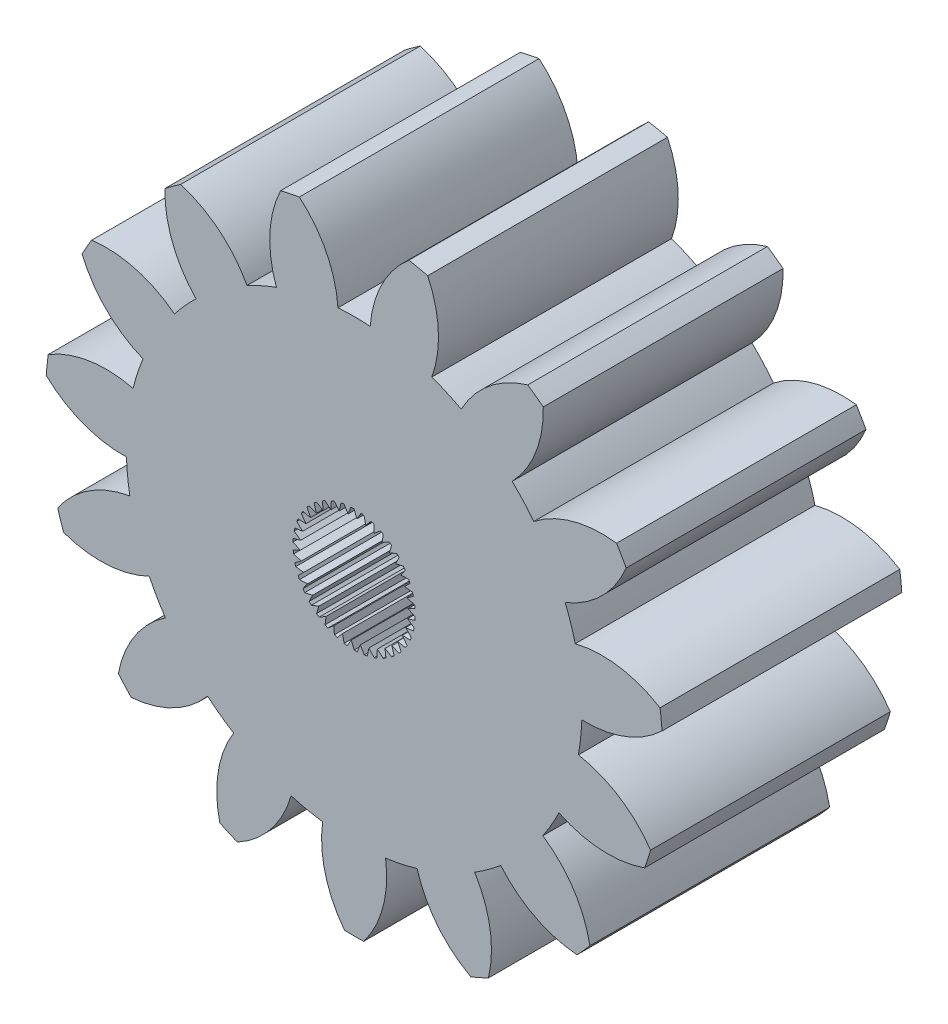
from build123d import *

# Parameters (mm, degrees)
SKETCH1_R           = 70.548036847
BOSS_EXTRUDE1_DEPTH = 10
SKETCH3_R           = 367.512428381
SKETCH3_R_2         = 2.25
CUT_EXTRUDE2_DEPTH  = 269.283414963
CUT_EXTRUDE4_DEPTH  = 10


with BuildPart() as part:
    # Sketch1 → Boss-Extrude1 (new body)
    with BuildSketch(Plane.XY):
        Circle(SKETCH1_R)
    extrude(amount=BOSS_EXTRUDE1_DEPTH)

    # Sketch3 → Cut-Extrude2 (cut, through all)
    # profile 1 of 2: a face of its own
    with BuildSketch(Plane(origin=(55.025604462, -141.718387499, 105.594585314), x_dir=(1, 0, 0), z_dir=(0, 0, 1))):
        with Locations((-43.46157653, 148.105383059)):
            Circle(SKETCH3_R)
        with BuildLine():
            ThreePointArc((-36.221197708, 158.75404699), (-37.83485513, 157.900828095), (-38.992966759, 156.489924055))
            ThreePointArc((-38.992966759, 156.489924055), (-39.597171684, 156.784978452), (-40.22073184, 157.036560288))
            ThreePointArc((-40.22073184, 157.036560288), (-39.94715374, 158.841284028), (-40.392836102, 160.611380068))
            ThreePointArc((-40.392836102, 160.611380068), (-40.784297687, 160.700989713), (-41.178363167, 160.778349))
            ThreePointArc((-41.178363167, 160.778349), (-42.305477185, 159.342561151), (-42.78959843, 157.582589738))
            ThreePointArc((-42.78959843, 157.582589738), (-43.46157653, 157.606383059), (-44.133554629, 157.582589738))
            ThreePointArc((-44.133554629, 157.582589738), (-44.617675875, 159.342561151), (-45.744789893, 160.778349))
            ThreePointArc((-45.744789893, 160.778349), (-46.138855372, 160.700989713), (-46.530316958, 160.611380068))
            ThreePointArc((-46.530316958, 160.611380068), (-46.97599932, 158.841284028), (-46.702421219, 157.036560288))
            ThreePointArc((-46.702421219, 157.036560288), (-47.325981376, 156.784978452), (-47.930186301, 156.489924055))
            ThreePointArc((-47.930186301, 156.489924055), (-49.08829793, 157.900828095), (-50.701955351, 158.75404699))
            ThreePointArc((-50.701955351, 158.75404699), (-51.030487224, 158.523094895), (-51.35165765, 158.282010639))
            ThreePointArc((-51.35165765, 158.282010639), (-51.038845826, 156.483672095), (-50.05487252, 154.946249158))
            ThreePointArc((-50.05487252, 154.946249158), (-50.522195517, 154.46279295), (-50.954154746, 153.947495063))
            ThreePointArc((-50.954154746, 153.947495063), (-52.586008738, 154.765373604), (-54.407193534, 154.888494247))
            ThreePointArc((-54.407193534, 154.888494247), (-54.613385654, 154.543883059), (-54.808731638, 154.193009851))
            ThreePointArc((-54.808731638, 154.193009851), (-53.791513634, 152.677377874), (-52.267283045, 151.673090132))
            ThreePointArc((-52.267283045, 151.673090132), (-52.497564491, 151.041353522), (-52.682588351, 150.394911831))
            ThreePointArc((-52.682588351, 150.394911831), (-54.506022324, 150.478346243), (-56.2198351, 149.850079957))
            ThreePointArc((-56.2198351, 149.850079957), (-56.268034976, 149.45139608), (-56.303779421, 149.051403085))
            ThreePointArc((-56.303779421, 149.051403085), (-54.758041473, 148.080544213), (-52.957106917, 147.783042142))
            ThreePointArc((-52.957106917, 147.783042142), (-52.910529058, 147.112258129), (-52.816625241, 146.446448275))
            ThreePointArc((-52.816625241, 146.446448275), (-54.516350897, 145.78101199), (-55.826457853, 144.509991723))
            ThreePointArc((-55.826457853, 144.509991723), (-55.70833129, 144.126171222), (-55.578293657, 143.746220863))
            ThreePointArc((-55.578293657, 143.746220863), (-53.771307897, 143.488005415), (-52.00506732, 143.948729824))
            ThreePointArc((-52.00506732, 143.948729824), (-51.689683891, 143.354883059), (-51.333089221, 142.784829614))
            ThreePointArc((-51.333089221, 142.784829614), (-52.615208552, 141.485582611), (-53.295080294, 139.791579314))
            ThreePointArc((-53.295080294, 139.791579314), (-53.031052447, 139.488988241), (-52.757717425, 139.194777386))
            ThreePointArc((-52.757717425, 139.194777386), (-51.001928107, 139.693853159), (-49.575780551, 140.833140613))
            ThreePointArc((-49.575780551, 140.833140613), (-49.046124212, 140.418912595), (-48.488497146, 140.04318298))
            ThreePointArc((-48.488497146, 140.04318298), (-49.131320073, 138.334776868), (-49.0634006, 136.510699101))
            ThreePointArc((-49.0634006, 136.510699101), (-48.699124283, 136.341658201), (-48.329753979, 136.18405858))
            ThreePointArc((-48.329753979, 136.18405858), (-46.928753027, 137.354130838), (-46.08929236, 138.974988187))
            ThreePointArc((-46.08929236, 138.974988187), (-45.436945504, 138.812002704), (-44.774704829, 138.695563981))
            ThreePointArc((-44.774704829, 138.695563981), (-44.667081426, 136.873397699), (-43.863114633, 135.234645079))
            ThreePointArc((-43.863114633, 135.234645079), (-43.46157653, 135.228383059), (-43.060038426, 135.234645079))
            ThreePointArc((-43.060038426, 135.234645079), (-42.256071633, 136.873397699), (-42.148448231, 138.695563981))
            ThreePointArc((-42.148448231, 138.695563981), (-41.486207555, 138.812002704), (-40.833860699, 138.974988187))
            ThreePointArc((-40.833860699, 138.974988187), (-39.994400032, 137.354130838), (-38.59339908, 136.18405858))
            ThreePointArc((-38.59339908, 136.18405858), (-38.224028777, 136.341658201), (-37.859752459, 136.510699101))
            ThreePointArc((-37.859752459, 136.510699101), (-37.791832987, 138.334776868), (-38.434655913, 140.04318298))
            ThreePointArc((-38.434655913, 140.04318298), (-37.877028848, 140.418912595), (-37.347372509, 140.833140613))
            ThreePointArc((-37.347372509, 140.833140613), (-35.921224952, 139.693853159), (-34.165435634, 139.194777386))
            ThreePointArc((-34.165435634, 139.194777386), (-33.892100612, 139.488988241), (-33.628072765, 139.791579314))
            ThreePointArc((-33.628072765, 139.791579314), (-34.307944507, 141.485582611), (-35.590063839, 142.784829614))
            ThreePointArc((-35.590063839, 142.784829614), (-35.233469168, 143.354883059), (-34.918085739, 143.948729824))
            ThreePointArc((-34.918085739, 143.948729824), (-33.151845163, 143.488005415), (-31.344859402, 143.746220863))
            ThreePointArc((-31.344859402, 143.746220863), (-31.214821769, 144.126171222), (-31.096695206, 144.509991723))
            ThreePointArc((-31.096695206, 144.509991723), (-32.406802163, 145.78101199), (-34.106527819, 146.446448275))
            ThreePointArc((-34.106527819, 146.446448275), (-34.012624002, 147.112258129), (-33.966046143, 147.783042142))
            ThreePointArc((-33.966046143, 147.783042142), (-32.165111587, 148.080544213), (-30.619373638, 149.051403085))
            ThreePointArc((-30.619373638, 149.051403085), (-30.655118083, 149.45139608), (-30.70331796, 149.850079957))
            ThreePointArc((-30.70331796, 149.850079957), (-32.417130736, 150.478346243), (-34.240564709, 150.394911831))
            ThreePointArc((-34.240564709, 150.394911831), (-34.425588568, 151.041353522), (-34.655870014, 151.673090132))
            ThreePointArc((-34.655870014, 151.673090132), (-33.131639425, 152.677377874), (-32.114421422, 154.193009851))
            ThreePointArc((-32.114421422, 154.193009851), (-32.309767405, 154.543883059), (-32.515959525, 154.888494247))
            ThreePointArc((-32.515959525, 154.888494247), (-34.337144322, 154.765373604), (-35.968998313, 153.947495063))
            ThreePointArc((-35.968998313, 153.947495063), (-36.400957543, 154.46279295), (-36.86828054, 154.946249158))
            ThreePointArc((-36.86828054, 154.946249158), (-35.884307233, 156.483672095), (-35.571495409, 158.282010639))
            ThreePointArc((-35.571495409, 158.282010639), (-35.892665836, 158.523094895), (-36.221197708, 158.75404699))
        make_face(mode=Mode.SUBTRACT)
    # profile 2 of 2: a face of its own
    with BuildSketch(Plane(origin=(55.025604462, -141.718387499, 105.594585314), x_dir=(1, 0, 0), z_dir=(0, 0, 1))):
        with Locations((-43.46157653, 148.105383059)):
            Circle(SKETCH3_R_2)
    extrude(amount=-CUT_EXTRUDE2_DEPTH, mode=Mode.SUBTRACT)

    # Sketch4 → Cut-Extrude4 (cut)
    with BuildSketch(Plane.XY.offset(10)):
        with BuildLine():
            ThreePointArc((9.619262983, 5.255452678), (9.532463271, 5.419914887), (9.459541205, 5.590983238))
            Line((9.459541205, 5.590983238), (9.229545604, 5.360987636))
            ThreePointArc((9.229545604, 5.360987636), (9.25663155, 5.301444117), (9.285235917, 5.242614963))
            Line((9.285235917, 5.242614963), (9.619262984, 5.255452678))
        make_face()
        with BuildLine():
            Line((9.127956814, 5.633299661), (9.459541205, 5.590983238))
            ThreePointArc((9.459541205, 5.590983238), (9.400994918, 5.76748916), (9.357224339, 5.948226939))
            Line((9.357224339, 5.948226939), (9.092509546, 5.759224209))
            ThreePointArc((9.092509546, 5.759224209), (9.109425534, 5.696034586), (9.127956814, 5.633299661))
        make_face()
        with BuildLine():
            Line((9.037127381, 6.044543218), (9.357224339, 5.948226939))
            ThreePointArc((9.357224339, 5.948226939), (9.328528467, 6.131961952), (9.315103323, 6.317439104))
            Line((9.315103322, 6.317439104), (9.022890067, 6.174584748))
            ThreePointArc((9.022890067, 6.174584748), (9.029174673, 6.109472669), (9.037127381, 6.044543218))
        make_face()
        with BuildLine():
            ThreePointArc((9.832032879, 4.950787658), (9.719347412, 5.098720054), (9.619262983, 5.255452678))
            Line((9.619262984, 5.255452678), (9.430260254, 4.990737885))
            ThreePointArc((9.430260254, 4.990737885), (9.466777324, 4.936464662), (9.504674525, 4.883145984))
            Line((9.504674526, 4.883145985), (9.83203288, 4.950787658))
        make_face()
        with BuildLine():
            Line((9.015225208, 6.465127982), (9.315103322, 6.317439104))
            ThreePointArc((9.315103323, 6.317439104), (9.317040614, 6.503391397), (9.334327107, 6.688548588))
            Line((9.334327106, 6.688548588), (9.022586204, 6.595739301))
            ThreePointArc((9.022586205, 6.595739301), (9.018068001, 6.530480853), (9.015225208, 6.465127982))
        make_face()
        with BuildLine():
            ThreePointArc((10.092047086, 4.685298646), (9.956549629, 4.812666018), (9.832032879, 4.950787658))
            Line((9.83203288, 4.950787658), (9.689178524, 4.658574403))
            ThreePointArc((9.689178524, 4.658574403), (9.734130628, 4.611051908), (9.780286926, 4.564698102))
            Line((9.780286927, 4.564698103), (10.092047086, 4.685298646))
        make_face()
        with BuildLine():
            Line((9.062847729, 6.883581498), (9.334327106, 6.688548588))
            ThreePointArc((9.334327107, 6.688548588), (9.366844717, 6.871645866), (9.414371317, 7.051432491))
            Line((9.414371316, 7.051432492), (9.091606247, 7.011199868))
            ThreePointArc((9.091606249, 7.011199868), (9.076408479, 6.947575132), (9.06284773, 6.883581498))
        make_face()
        with BuildLine():
            ThreePointArc((10.392213092, 4.466227489), (10.237599664, 4.569555588), (10.092047086, 4.685298646))
            Line((10.092047086, 4.685298646), (9.999237799, 4.373557745))
            ThreePointArc((9.999237798, 4.373557744), (10.05139876, 4.334082267), (10.104555132, 4.295957744))
            Line((10.104555133, 4.295957745), (10.392213093, 4.46622749))
        make_face()
        with BuildLine():
            Line((9.178695925, 7.288489444), (9.414371316, 7.051432492))
            ThreePointArc((9.414371317, 7.051432491), (9.476582251, 7.226680338), (9.553052556, 7.396192287))
            Line((9.553052554, 7.396192288), (9.228067509, 7.409633769))
            ThreePointArc((9.22806751, 7.409633768), (9.202604731, 7.349378262), (9.178695926, 7.288489443))
        make_face()
        with BuildLine():
            ThreePointArc((10.724343153, 4.299549879), (10.554831204, 4.376020183), (10.392213092, 4.466227489))
            Line((10.392213093, 4.46622749), (10.351980469, 4.143462422))
            ThreePointArc((10.351980469, 4.143462421), (10.409927472, 4.11311075), (10.468633951, 4.084255447))
            Line((10.468633952, 4.084255448), (10.724343154, 4.29954988))
        make_face()
        with BuildLine():
            Line((9.359609761, 7.668806986), (9.553052554, 7.396192288))
            ThreePointArc((9.553052556, 7.396192287), (9.643259861, 7.558810399), (9.74658796, 7.713423827))
            Line((9.746587959, 7.713423828), (9.428247681, 7.780172765))
            ThreePointArc((9.428247682, 7.780172764), (9.393214452, 7.7249301), (9.359609762, 7.668806986))
        make_face()
        with BuildLine():
            ThreePointArc((11.079377626, 4.189812345), (10.899591001, 4.237338944), (10.724343153, 4.299549879))
            Line((10.724343154, 4.29954988), (10.737784635, 3.974564834))
            ThreePointArc((10.737784634, 3.974564833), (10.799937037, 3.954164882), (10.862592263, 3.935365897))
            Line((10.862592264, 3.935365899), (11.079377626, 4.189812346))
        make_face()
        with BuildLine():
            Line((9.600654378, 8.014160055), (9.746587959, 7.713423828))
            ThreePointArc((9.74658796, 7.713423827), (9.862331017, 7.858976405), (9.98969839, 7.994473862))
            Line((9.989698389, 7.994473863), (9.686686371, 8.112709519))
            ThreePointArc((9.686686372, 8.112709518), (9.643038306, 8.063986572), (9.600654379, 8.014160054))
        make_face()
        with BuildLine():
            ThreePointArc((11.447632096, 4.140008241), (11.262474904, 4.157294734), (11.079377626, 4.189812345))
            Line((11.079377626, 4.189812346), (11.146126563, 3.871472068))
            ThreePointArc((11.146126563, 3.871472066), (11.21078901, 3.861580294), (11.275683911, 3.853350414))
            Line((11.275683912, 3.853350416), (11.447632096, 4.140008243))
        make_face()
        with BuildLine():
            Line((9.895254707, 8.315128317), (9.989698389, 7.994473863))
            ThreePointArc((9.98969839, 7.994473862), (10.127820029, 8.118990611), (10.275752425, 8.231676079))
            Line((10.275752424, 8.23167608), (9.996334045, 8.398173295))
            ThreePointArc((9.996334046, 8.398173294), (9.945261749, 8.3572991), (9.895254708, 8.315128316))
        make_face()
        with BuildLine():
            ThreePointArc((11.819061541, 4.151496095), (11.633584389, 4.13807095), (11.447632096, 4.140008241))
            Line((11.447632096, 4.140008243), (11.565867752, 3.836996225))
            ThreePointArc((11.565867752, 3.836996224), (11.63127642, 3.837882451), (11.696640833, 3.840446165))
            Line((11.696640833, 3.840446167), (11.81906154, 4.151496096))
        make_face()
        with BuildLine():
            Line((10.23537482, 8.563502145), (10.275752424, 8.23167608))
            ThreePointArc((10.275752425, 8.231676079), (10.432485049, 8.331760507), (10.596947258, 8.41856022))
            Line((10.596947257, 8.418560222), (10.348744321, 8.628777385))
            ThreePointArc((10.348744322, 8.628777383), (10.291640914, 8.596866885), (10.235374821, 8.563502143))
        make_face()
        with BuildLine():
            ThreePointArc((12.183534333, 4.223962546), (12.002796554, 4.180191967), (11.819061541, 4.151496095))
            Line((11.81906154, 4.151496096), (11.985558755, 3.872077717))
            ThreePointArc((11.985558756, 3.872077715), (12.049929466, 3.883717769), (12.11398042, 3.897005146))
            Line((12.11398042, 3.897005148), (12.183534333, 4.223962548))
        make_face()
        with BuildLine():
            Line((10.611737126, 8.752506546), (10.596947257, 8.418560222))
            ThreePointArc((10.596947258, 8.41856022), (10.768015608, 8.491482285), (10.94452153, 8.550028573))
            Line((10.94452153, 8.550028575), (10.734304366, 8.798231511))
            ThreePointArc((10.734304367, 8.798231509), (10.672727479, 8.77615514), (10.611737127, 8.752506545))
        make_face()
        with BuildLine():
            ThreePointArc((12.531108606, 4.3554309), (12.360040256, 4.282508834), (12.183534333, 4.223962546))
            Line((12.183534333, 4.223962548), (12.393751496, 3.975759612))
            ThreePointArc((12.393751497, 3.97575961), (12.455328385, 3.997835979), (12.516318737, 4.021484575))
            Line((12.516318737, 4.021484576), (12.531108606, 4.355430901))
        make_face()
        with BuildLine():
            Line((11.014075443, 8.876985975), (10.94452153, 8.550028575))
            ThreePointArc((10.94452153, 8.550028573), (11.125259309, 8.593799152), (11.308994322, 8.622495024))
            Line((11.308994322, 8.622495026), (11.142497107, 8.901913406))
            ThreePointArc((11.142497108, 8.901913404), (11.078126398, 8.89027335), (11.014075443, 8.876985973))
        make_face()
        with BuildLine():
            ThreePointArc((12.85230344, 4.542315041), (12.695570816, 4.442230612), (12.531108606, 4.3554309))
            Line((12.531108606, 4.355430901), (12.779311542, 4.145213737))
            ThreePointArc((12.779311542, 4.145213736), (12.836414951, 4.177124235), (12.892681044, 4.210488976))
            Line((12.892681043, 4.210488978), (12.852303439, 4.542315043))
        make_face()
        with BuildLine():
            Line((11.43141503, 8.933544955), (11.308994322, 8.622495026))
            ThreePointArc((11.308994322, 8.622495024), (11.494471474, 8.635920169), (11.680423767, 8.633982878))
            Line((11.680423767, 8.63398288), (11.562188111, 8.936994898))
            ThreePointArc((11.562188111, 8.936994895), (11.496779443, 8.936108668), (11.43141503, 8.933544954))
        make_face()
        with BuildLine():
            ThreePointArc((13.138357475, 4.779517259), (13.000235835, 4.655000509), (12.85230344, 4.542315041))
            Line((12.852303439, 4.542315043), (13.131721818, 4.375817828))
            ThreePointArc((13.131721819, 4.375817826), (13.182794116, 4.416692019), (13.232801157, 4.458862804))
            Line((13.232801155, 4.458862805), (13.138357474, 4.77951726))
        make_face()
        with BuildLine():
            Line((11.852371951, 8.920640707), (11.680423767, 8.63398288))
            ThreePointArc((11.680423767, 8.633982878), (11.865580958, 8.616696385), (12.048678236, 8.584178775))
            Line((12.048678236, 8.584178776), (11.981929299, 8.902519055))
            ThreePointArc((11.981929299, 8.902519053), (11.917266852, 8.912410825), (11.852371951, 8.920640705))
        make_face()
        with BuildLine():
            ThreePointArc((13.381467905, 5.060567294), (13.265724848, 4.915014715), (13.138357475, 4.779517259))
            Line((13.138357474, 4.77951726), (13.441369492, 4.661281603))
            ThreePointArc((13.441369493, 4.661281602), (13.485017559, 4.710004549), (13.527401486, 4.759831067))
            Line((13.527401485, 4.759831068), (13.381467903, 5.060567295))
        make_face()
        with BuildLine():
            Line((12.265463599, 8.838625224), (12.048678236, 8.584178776))
            ThreePointArc((12.048678236, 8.584178775), (12.228464861, 8.536652175), (12.403712708, 8.474441241))
            Line((12.403712709, 8.474441243), (12.390271228, 8.799426289))
            ThreePointArc((12.390271227, 8.799426287), (12.328118824, 8.819826237), (12.265463599, 8.838625222))
        make_face()
        with BuildLine():
            ThreePointArc((13.575003309, 5.377798834), (13.484796004, 5.215180722), (13.381467905, 5.060567294))
            Line((13.381467903, 5.060567295), (13.699808182, 4.993818357))
            ThreePointArc((13.699808183, 4.993818357), (13.734841413, 5.049061021), (13.768446103, 5.105184136))
            Line((13.768446102, 5.105184136), (13.575003308, 5.377798835))
        make_face()
        with BuildLine():
            Line((12.659421911, 8.689735674), (12.403712709, 8.474441243))
            ThreePointArc((12.403712708, 8.474441241), (12.573224657, 8.397970937), (12.735842769, 8.307763631))
            Line((12.73584277, 8.307763633), (12.776075394, 8.630528701))
            ThreePointArc((12.776075393, 8.6305287), (12.718128389, 8.66088037), (12.65942191, 8.689735673))
        make_face()
        with BuildLine():
            ThreePointArc((13.713684548, 5.722558631), (13.651473614, 5.547310783), (13.575003309, 5.377798834))
            Line((13.575003308, 5.377798835), (13.899988354, 5.364357354))
            ThreePointArc((13.899988355, 5.364357353), (13.925451134, 5.42461286), (13.949359938, 5.485501679))
            Line((13.949359937, 5.485501679), (13.713684547, 5.722558631))
        make_face()
        with BuildLine():
            Line((13.02350073, 8.478033377), (12.73584277, 8.307763633))
            ThreePointArc((12.735842769, 8.307763631), (12.890456197, 8.204435532), (13.036008776, 8.088692476))
            Line((13.036008776, 8.088692476), (13.128818064, 8.400433378))
            ThreePointArc((13.128818063, 8.400433377), (13.076657102, 8.439908854), (13.023500729, 8.478033376))
        make_face()
        with BuildLine():
            ThreePointArc((13.793728757, 6.085442535), (13.761211147, 5.902345256), (13.713684548, 5.722558631))
            Line((13.713684547, 5.722558631), (14.036449615, 5.762791255))
            ThreePointArc((14.036449616, 5.762791255), (14.051647385, 5.82641599), (14.065208135, 5.890409625))
            Line((14.065208134, 5.890409625), (13.793728757, 6.085442535))
        make_face()
        with BuildLine():
            Line((13.347768936, 8.20929302), (13.036008776, 8.088692476))
            ThreePointArc((13.036008776, 8.088692476), (13.171506232, 7.961325103), (13.296022982, 7.823203464))
            Line((13.296022983, 7.823203464), (13.438877338, 8.11541672))
            ThreePointArc((13.438877338, 8.115416719), (13.393925234, 8.162939214), (13.347768935, 8.209293019))
        make_face()
        with BuildLine():
            ThreePointArc((13.812952541, 6.456552019), (13.81101525, 6.270599726), (13.793728757, 6.085442535))
            Line((13.793728757, 6.085442535), (14.105469658, 6.178251822))
            ThreePointArc((14.105469659, 6.178251822), (14.109987863, 6.24351027), (14.112830655, 6.30886314))
            Line((14.112830655, 6.30886314), (13.812952541, 6.456552019))
        make_face()
        with BuildLine():
            Line((13.623381337, 7.890845138), (13.296022983, 7.823203464))
            ThreePointArc((13.296022982, 7.823203464), (13.40870845, 7.675271068), (13.508792879, 7.518538444))
            Line((13.508792879, 7.518538445), (13.697795609, 7.783253238))
            ThreePointArc((13.697795608, 7.783253237), (13.661278538, 7.83752646), (13.623381337, 7.890845137))
        make_face()
        with BuildLine():
            Line((13.842819946, 7.53137616), (13.508792879, 7.518538445))
            ThreePointArc((13.508792879, 7.518538444), (13.595592591, 7.354076235), (13.668514657, 7.183007885))
            Line((13.668514657, 7.183007885), (13.898510259, 7.413003486))
            ThreePointArc((13.898510258, 7.413003486), (13.871424312, 7.472547005), (13.842819945, 7.53137616))
        make_face()
        with BuildLine():
            ThreePointArc((13.770831524, 6.825764184), (13.799527396, 6.64202917), (13.812952541, 6.456552019))
            Line((13.812952541, 6.456552019), (14.105165796, 6.599406374))
            ThreePointArc((14.105165796, 6.599406374), (14.09888119, 6.664518454), (14.090928482, 6.729447905))
            Line((14.090928482, 6.729447905), (13.770831524, 6.825764184))
        make_face()
        with BuildLine():
            Line((14.000099048, 7.140691462), (13.668514657, 7.183007885))
            ThreePointArc((13.668514657, 7.183007885), (13.727060945, 7.006501963), (13.770831524, 6.825764184))
            Line((13.770831524, 6.825764184), (14.035546317, 7.014766913))
            ThreePointArc((14.035546317, 7.014766913), (14.018630329, 7.077956537), (14.000099048, 7.140691462))
        make_face()
    extrude(amount=-CUT_EXTRUDE4_DEPTH, mode=Mode.SUBTRACT)


solid = part.part
